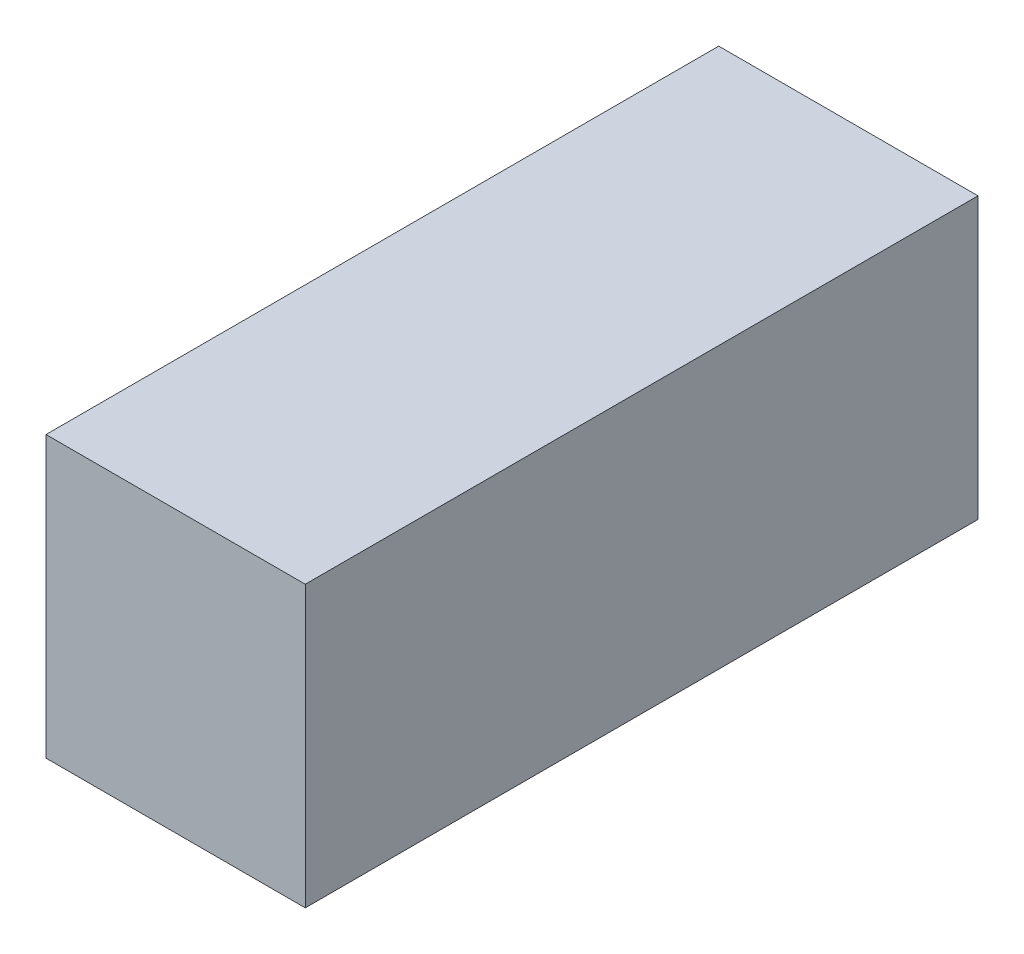
from build123d import *

# Parameters (mm, degrees)
SKETCH1_W           = 185
SKETCH1_H           = 200
BOSS_EXTRUDE1_DEPTH = 480


with BuildPart() as part:
    # Sketch1 → Boss-Extrude1 (new body)
    with BuildSketch(Plane.XY):
        with Locations((92.5, 100)):
            Rectangle(SKETCH1_W, SKETCH1_H)
    extrude(amount=BOSS_EXTRUDE1_DEPTH)


solid = part.part
